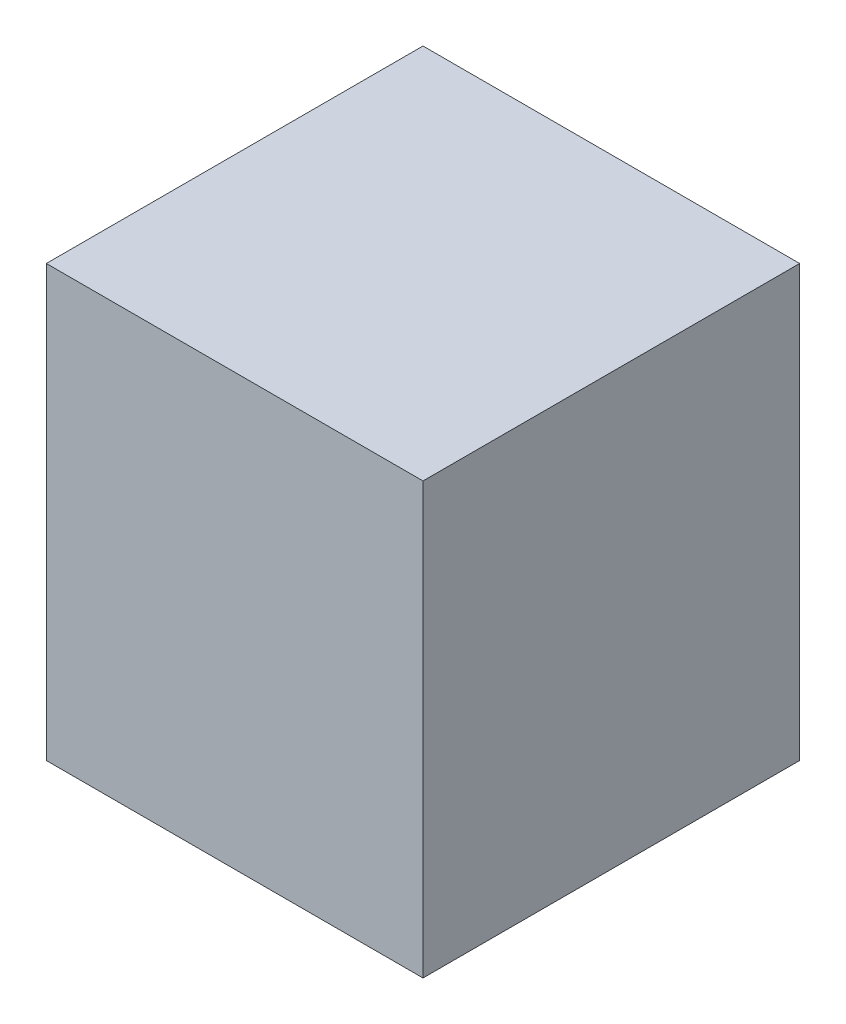
from build123d import *

# Parameters (mm, degrees)
SKETCH1_W           = 140
SKETCH1_H           = 160
SKETCH1_W_2         = 120
SKETCH1_H_2         = 140
EXTRUDE_THIN1_DEPTH = 60
SKETCH2_W           = 140
SKETCH2_H           = 160
BOSS_EXTRUDE1_DEPTH = 10
SKETCH5_W           = 140
SKETCH5_H           = 160
BOSS_EXTRUDE2_DEPTH = 10
SKETCH7_W           = 121.54877743
SKETCH7_H           = 125.094770936
CUT_EXTRUDE2_DEPTH  = 40


with BuildPart() as part:
    # Sketch1 → Extrude-Thin1 (new, symmetric)
    with BuildSketch(Plane.XY):
        Rectangle(SKETCH1_W, SKETCH1_H)
        Rectangle(SKETCH1_W_2, SKETCH1_H_2, mode=Mode.SUBTRACT)
    extrude(amount=EXTRUDE_THIN1_DEPTH, both=True)

    # Sketch2 → Boss-Extrude1 (add)
    with BuildSketch(Plane.XY.offset(60)):
        Rectangle(SKETCH2_W, SKETCH2_H)
    extrude(amount=BOSS_EXTRUDE1_DEPTH)

    # Sketch5 → Boss-Extrude2 (add)
    with BuildSketch(Plane(origin=(0, 0, -60), x_dir=(-1, 0, 0), z_dir=(0, 0, -1))):
        Rectangle(SKETCH5_W, SKETCH5_H)
    extrude(amount=BOSS_EXTRUDE2_DEPTH)

    # Sketch7 → Cut-Extrude2 (cut)
    with BuildSketch(Plane.XZ.offset(80)):
        Rectangle(SKETCH7_W, SKETCH7_H)
    extrude(amount=-CUT_EXTRUDE2_DEPTH, mode=Mode.SUBTRACT)


solid = part.part
